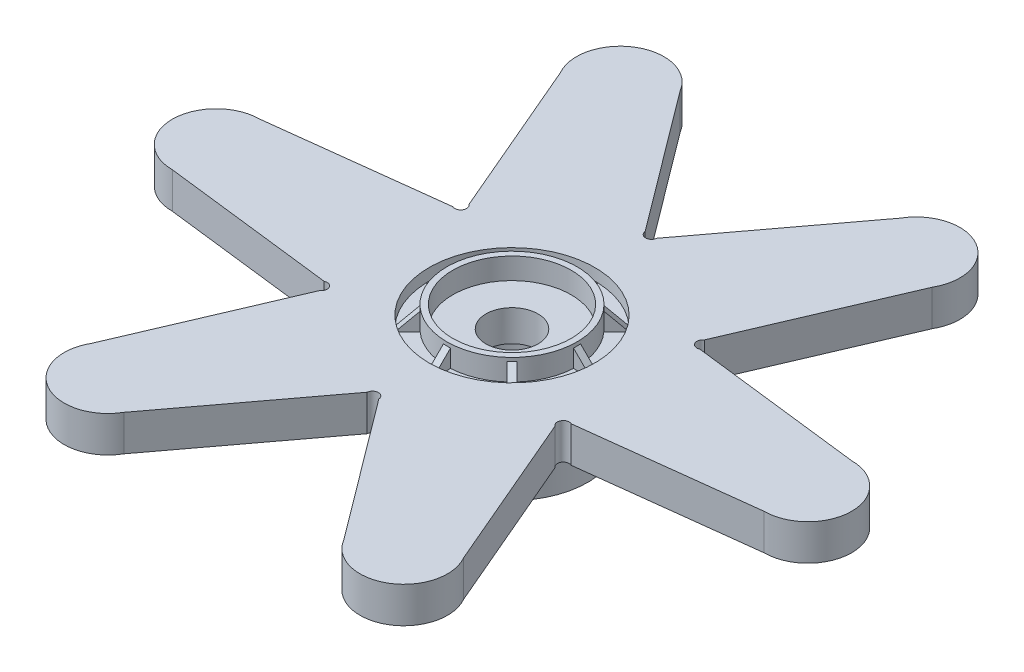
from build123d import *

# Parameters (mm, degrees)
EXTRUDE4_DEPTH          = 1.9304
SKETCH2_R               = 0.6604
CUT_EXTRUDE1_DEPTH      = 19.722050478
CIRPATTERN4_COUNT       = 6
CUT_EXTRUDE2_DEPTH      = 12.7
CUT_EXTRUDE2_DEPTH_BACK = 12.7
SKETCH3_R               = 1.397
SKETCH4_R               = 4.445
CUT_EXTRUDE3_DEPTH      = 0.635
SKETCH5_R               = 3.4925
SKETCH5_R_2             = 3.175
EXTRUDE5_DEPTH          = 1.143
RIB10_REACH             = 26.438
SKETCH8_WALL_W          = 52.220152264
SKETCH8_WALL_H          = 0.381
CIRPATTERN5_COUNT       = 8
SKETCH10_R              = 5.08
EXTRUDE6_DEPTH          = 0.762
FILLET2_R               = 0.508
SKETCH11_R              = 4.064
EXTRUDE7_DEPTH          = 3.048
FILLET3_R               = 0.889
SKETCH12_R              = 2.8575
CUT_EXTRUDE5_DEPTH      = 3.429
SKETCH14_R              = 1.397
CUT_EXTRUDE6_DEPTH      = 25.557003564
SKETCH15_R              = 0.3175
CUT_EXTRUDE7_DEPTH      = 25.984806887
CIRPATTERN7_COUNT       = 6


with BuildPart() as part:
    # Sketch1 → Extrude4 (new body)
    with BuildSketch(Plane(origin=(0, 0, 0), x_dir=(1, 0, 0), z_dir=(0, 1, 0))):
        with BuildLine():
            Line((5.775220615, -3.829827046), (0, 0))
            Line((0, 0), (5.775220615, 3.829827046))
            Line((5.775220615, 3.829827046), (6.35029977, 3.829827046))
            Line((6.35029977, 3.829827046), (6.35029977, 3.494998084))
            Line((6.35029977, 3.494998084), (15.87469147, 2.35207108))
            ThreePointArc((15.87469147, 2.35207108), (18.22419147, 0.00257108), (15.87469147, -2.34692892))
            Line((15.87469147, -2.34692892), (6.34969147, -3.48992892))
            Line((6.34969147, -3.48992892), (6.34969147, -3.829827046))
            Line((6.34969147, -3.829827046), (5.775220615, -3.829827046))
        make_face()
    extrude4 = extrude(amount=EXTRUDE4_DEPTH)

    # Sketch2 → Cut-Extrude1 (cut, through all)
    with BuildSketch(Plane(origin=(0, 1.9304, 0), x_dir=(-1, 0, 0), z_dir=(0, 1, 0))):
        with Locations((-6.342552501, -4.149920748)):
            Circle(SKETCH2_R)
        with Locations((-6.342552501, 4.149920748)):
            Circle(SKETCH2_R)
    extrude(amount=-CUT_EXTRUDE1_DEPTH, mode=Mode.SUBTRACT)

    # CirPattern4: Extrude4 ×6 about axis
    cirpattern4_axis = Axis((0, 0, 0), (0, 1, 0))
    for i in range(1, CIRPATTERN4_COUNT):
        add(extrude4.rotate(cirpattern4_axis, i * 360 / CIRPATTERN4_COUNT))

    # Sketch3 → Cut-Extrude2 (cut, two sides: drawn at the far end of the back side and taken through both)
    with BuildSketch(Plane(origin=(0, 1.9304, 0), x_dir=(-1, 0, 0), z_dir=(0, 1, 0)).offset(-CUT_EXTRUDE2_DEPTH_BACK)):
        Circle(SKETCH3_R)
    extrude(amount=CUT_EXTRUDE2_DEPTH + CUT_EXTRUDE2_DEPTH_BACK, mode=Mode.SUBTRACT)

    # Sketch4 → Cut-Extrude3 (cut)
    with BuildSketch(Plane(origin=(0, 1.9304, 0), x_dir=(-1, 0, 0), z_dir=(0, 1, 0))):
        Circle(SKETCH4_R)
    extrude(amount=-CUT_EXTRUDE3_DEPTH, mode=Mode.SUBTRACT)

    # Sketch5 → Extrude5 (add)
    with BuildSketch(Plane(origin=(0, 1.2954, 0), x_dir=(-1, 0, 0), z_dir=(0, 1, 0))):
        Circle(SKETCH5_R)
        Circle(SKETCH5_R_2, mode=Mode.SUBTRACT)
    extrude(amount=EXTRUDE5_DEPTH)

    # Sketch8 wall → Rib10 (add, up to next)
    with BuildSketch(Plane(origin=(-3.967749561, 1.770078976, 0), x_dir=(-0.70753138537, -0.706681921883, 0), z_dir=(0.706681921883, -0.70753138537, 0)), mode=Mode.PRIVATE) as rib10_sk1:
        Rectangle(SKETCH8_WALL_W, SKETCH8_WALL_H)
    rib10_tool1 = extrude(rib10_sk1.sketch, amount=RIB10_REACH, mode=Mode.PRIVATE) - part.part
    rib10 = rib10_tool1.solids().sort_by_distance((-3.967749561, 1.770078976, 0))[0]
    add(rib10)

    # CirPattern5: Rib10 ×8 about axis
    cirpattern5_axis = Axis((0, 0, 0), (0, 1, 0))
    for i in range(1, CIRPATTERN5_COUNT):
        add(rib10.rotate(cirpattern5_axis, i * 360 / CIRPATTERN5_COUNT))

    # Sketch10 → Extrude6 (add)
    with BuildSketch(Plane.XZ):
        Circle(SKETCH10_R)
    extrude(amount=EXTRUDE6_DEPTH)

    # Fillet2
    fillet2_edges = [part.edges().sort_by_distance(p)[0] for p in [
        (-5.08, 0, 0),
    ]]
    fillet(fillet2_edges, radius=FILLET2_R)

    # Sketch11 → Extrude7 (add)
    with BuildSketch(Plane.XZ.offset(0.762)):
        Circle(SKETCH11_R)
    extrude(amount=EXTRUDE7_DEPTH)

    # Fillet3
    fillet3_edges = [part.edges().sort_by_distance(p)[0] for p in [
        (-4.064, -0.762, 0),
    ]]
    fillet(fillet3_edges, radius=FILLET3_R)

    # Sketch12 → Cut-Extrude5 (cut)
    with BuildSketch(Plane.XZ.offset(3.81)):
        Circle(SKETCH12_R)
    extrude(amount=-CUT_EXTRUDE5_DEPTH, mode=Mode.SUBTRACT)

    # Sketch14 → Cut-Extrude6 (cut, through all)
    with BuildSketch(Plane.XZ.offset(0.381)):
        Circle(SKETCH14_R)
    extrude(amount=-CUT_EXTRUDE6_DEPTH, mode=Mode.SUBTRACT)

    # Sketch15 → Cut-Extrude7 (cut, symmetric)
    with BuildSketch(Plane(origin=(0, 1.9304, 0), x_dir=(-1, 0, 0), z_dir=(0, 1, 0))):
        with Locations((-6.48724684, -3.751940905)):
            Circle(SKETCH15_R)
    cut_extrude7 = extrude(amount=CUT_EXTRUDE7_DEPTH, both=True, mode=Mode.SUBTRACT)

    # CirPattern7: Cut-Extrude7 ×6 about axis
    cirpattern7_axis = Axis((0, 0, 0), (0, 1, 0))
    for i in range(1, CIRPATTERN7_COUNT):
        add(cut_extrude7.rotate(cirpattern7_axis, i * 360 / CIRPATTERN7_COUNT), mode=Mode.SUBTRACT)


solid = part.part
